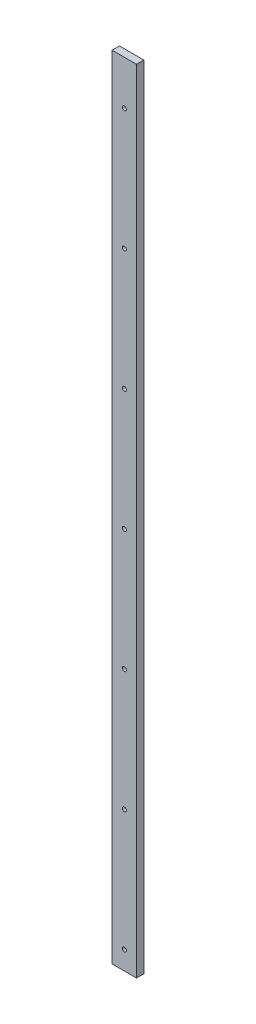
from build123d import *

# Parameters (mm, degrees)
SKETCH1_W           = 40
SKETCH1_H           = 12
BOSS_EXTRUDE1_DEPTH = 1303.36
SKETCH2_R           = 3.4
CUT_EXTRUDE1_DEPTH  = 1304.568674677


with BuildPart() as part:
    # Sketch1 → Boss-Extrude1 (new body)
    with BuildSketch(Plane(origin=(0, 0, 0), x_dir=(1, 0, 0), z_dir=(0, 1, 0))):
        Rectangle(SKETCH1_W, SKETCH1_H)
    extrude(amount=-BOSS_EXTRUDE1_DEPTH)

    # Sketch2 → Cut-Extrude1 (cut, through all)
    with BuildSketch(Plane.XY.offset(6)):
        with Locations((0, -1072.83)):
            Circle(SKETCH2_R)
        with Locations((0, -872.83)):
            Circle(SKETCH2_R)
        with Locations((0, -472.83)):
            Circle(SKETCH2_R)
        with Locations((0, -272.83)):
            Circle(SKETCH2_R)
        with Locations((0, -72.83)):
            Circle(SKETCH2_R)
        with Locations((0, -672.83)):
            Circle(SKETCH2_R)
        with Locations((0, -1272.83)):
            Circle(SKETCH2_R)
    extrude(amount=-CUT_EXTRUDE1_DEPTH, mode=Mode.SUBTRACT)


solid = part.part
